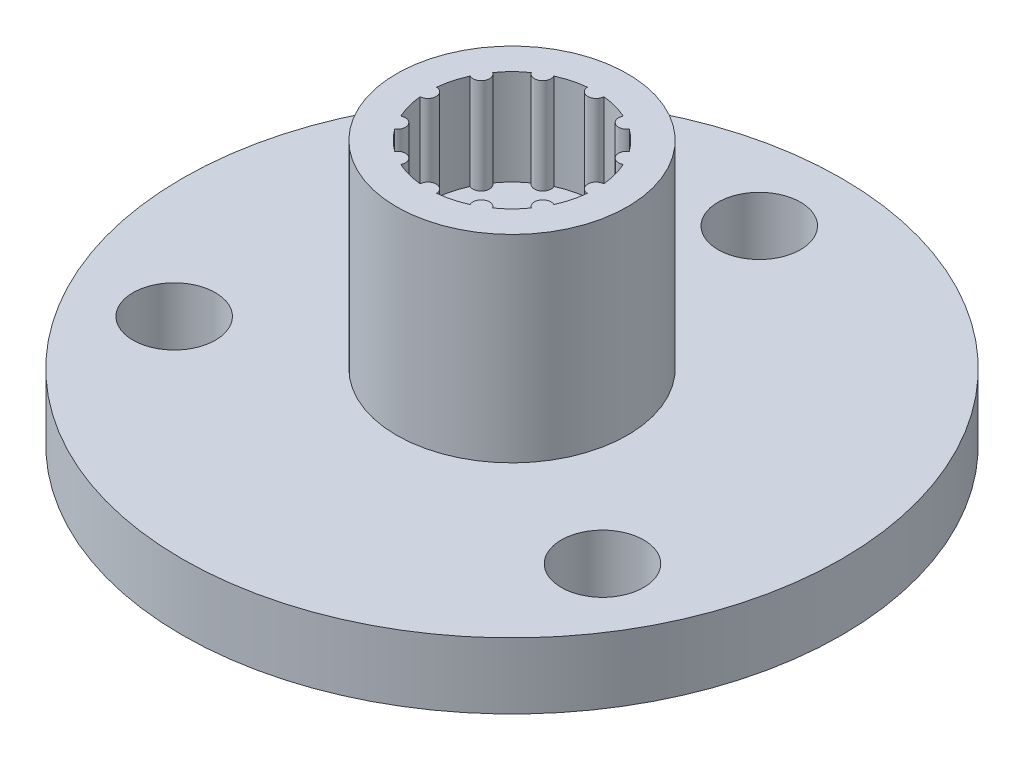
from build123d import *

# Parameters (mm, degrees)
SKETCH1_R           = 10
SKETCH1_R_2         = 1
BOSS_EXTRUDE1_DEPTH = 2
SKETCH2_R           = 3.5
SKETCH2_R_2         = 2.55
BOSS_EXTRUDE2_DEPTH = 6
CUT_EXTRUDE1_REACH  = 17.362
SKETCH3_R           = 1.25
CIRPATTERN1_COUNT   = 3
SKETCH4_R           = 2.55
SKETCH4_R_2         = 1
BOSS_EXTRUDE3_DEPTH = 3.1
SKETCH5_R           = 2
CUT_EXTRUDE2_DEPTH  = 4.1
BOSS_EXTRUDE4_START = -2.9
BOSS_EXTRUDE4_DEPTH = 2.9
CIRPATTERN2_COUNT   = 12


with BuildPart() as part:
    # Sketch1 → Boss-Extrude1 (new body)
    with BuildSketch(Plane(origin=(0, 0, 0), x_dir=(1, 0, 0), z_dir=(0, 1, 0))):
        with Locations(Location((0, 0, 0), (0, 0, 270))):
            Circle(SKETCH1_R)
        with Locations(Location((0, 0, 0), (0, 0, 270))):
            Circle(SKETCH1_R_2, mode=Mode.SUBTRACT)
    extrude(amount=BOSS_EXTRUDE1_DEPTH)

    # Sketch2 → Boss-Extrude2 (add)
    with BuildSketch(Plane(origin=(0, 2, 0), x_dir=(1, 0, 0), z_dir=(0, 1, 0))):
        with Locations(Location((0, 0, 0), (0, 0, 270))):
            Circle(SKETCH2_R)
        with Locations(Location((0, 0, 0), (0, 0, 270))):
            Circle(SKETCH2_R_2, mode=Mode.SUBTRACT)
    extrude(amount=BOSS_EXTRUDE2_DEPTH)

    # Sketch3 → Cut-Extrude1 (cut, up to next)
    with BuildSketch(Plane(origin=(0, 2, 0), x_dir=(1, 0, 0), z_dir=(0, 1, 0)), mode=Mode.PRIVATE) as cut_extrude1_sk1:
        with Locations(Location((0, 7.5, 0), (0, 0, 270))):
            Circle(SKETCH3_R)
    cut_extrude1_tool1 = extrude(cut_extrude1_sk1.sketch, amount=-CUT_EXTRUDE1_REACH, mode=Mode.PRIVATE) & part.part
    cut_extrude1 = cut_extrude1_tool1.solids().sort_by_distance((0, 2, -7.5))[0]
    add(cut_extrude1, mode=Mode.SUBTRACT)

    # CirPattern1: Cut-Extrude1 ×3 about axis
    cirpattern1_axis = Axis((0, 0, 0), (0, 1, 0))
    for i in range(1, CIRPATTERN1_COUNT):
        add(cut_extrude1.rotate(cirpattern1_axis, i * 360 / CIRPATTERN1_COUNT), mode=Mode.SUBTRACT)

    # Sketch4 → Boss-Extrude3 (add)
    with BuildSketch(Plane(origin=(0, 2, 0), x_dir=(1, 0, 0), z_dir=(0, 1, 0))):
        with Locations(Location((0, 0, 0), (0, 0, 270))):
            Circle(SKETCH4_R)
        with Locations(Location((0, 0, 0), (0, 0, 270))):
            Circle(SKETCH4_R_2, mode=Mode.SUBTRACT)
    extrude(amount=BOSS_EXTRUDE3_DEPTH)

    # Sketch5 → Cut-Extrude2 (cut)
    with BuildSketch(Plane.XZ):
        with Locations(Location((0, 0, 0), (0, 0, 270))):
            Circle(SKETCH5_R)
    extrude(amount=-CUT_EXTRUDE2_DEPTH, mode=Mode.SUBTRACT)

    # Sketch6 → Boss-Extrude4 (add)
    with BuildSketch(Plane(origin=(0, 8, 0), x_dir=(1, 0, 0), z_dir=(0, 1, 0)).offset(BOSS_EXTRUDE4_START)):
        with BuildLine():
            ThreePointArc((-0.249699454, 2.537745098), (0, 2.3), (0.249699454, 2.537745098))
            ThreePointArc((0.249699454, 2.537745098), (0, 2.55), (-0.249699454, 2.537745098))
        make_face()
    boss_extrude4 = extrude(amount=BOSS_EXTRUDE4_DEPTH)

    # CirPattern2: Boss-Extrude4 ×12 about axis
    cirpattern2_axis = Axis((0, 0, 0), (0, 1, 0))
    for i in range(1, CIRPATTERN2_COUNT):
        add(boss_extrude4.rotate(cirpattern2_axis, i * 360 / CIRPATTERN2_COUNT))


solid = part.part
